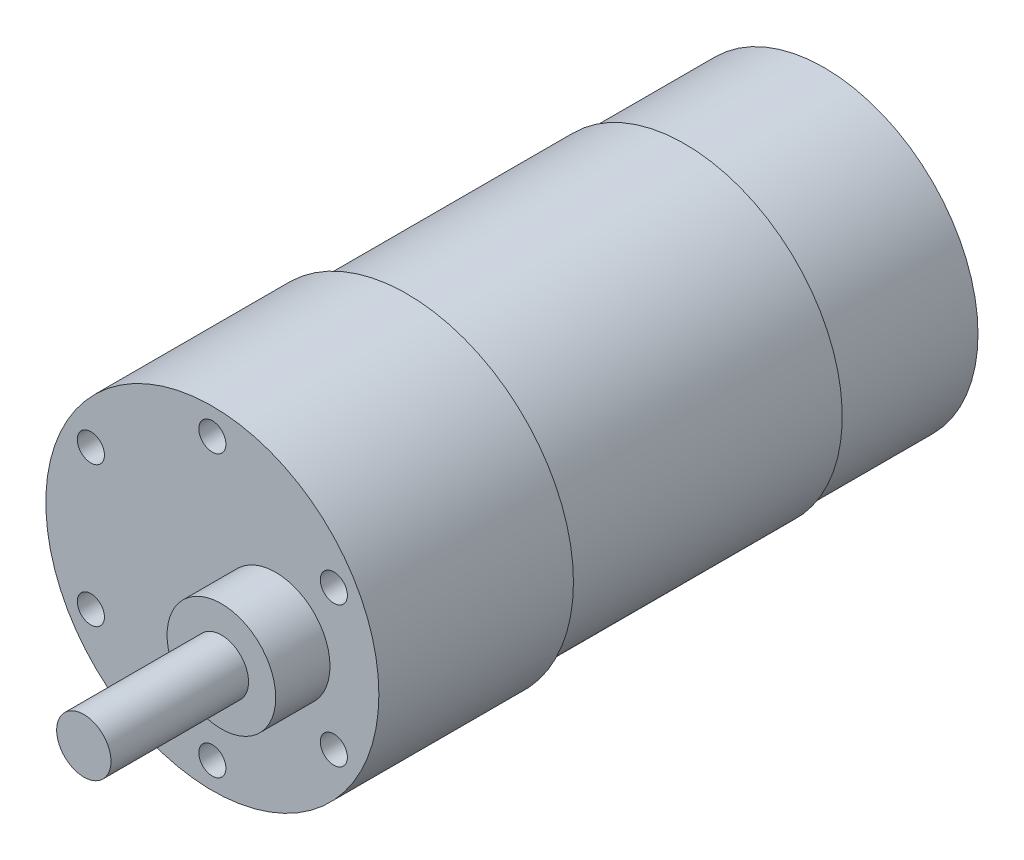
from build123d import *

# Parameters (mm, degrees)
SKETCH_1_R          = 18.4
EXTRUDE_1_DEPTH     = 21.5
SKETCH_1_3_R        = 6
EXTRUDE_2_DEPTH     = 6
SKETCH_1_4_R        = 3
EXTRUDE_3_DEPTH     = 21.2
SKETCH_2_R          = 17.4
EXTRUDE_4_DEPTH     = 30.7
EXTRUDE_START       = 30.7
SKETCH_2_3_R        = 17
EXTRUDE_5_DEPTH     = 15.4
SKETCH_1_5_R        = 1.5
CUT_EXTRUDE_1_DEPTH = 5


with BuildPart() as part:
    # 스케치1 → 보스-돌출1 (new body)
    with BuildSketch(Plane.XY):
        Circle(SKETCH_1_R)
    extrude(amount=-EXTRUDE_1_DEPTH)

    # 스케치1<3> → 보스-돌출2 (add)
    with BuildSketch(Plane.XY):
        with Locations((7, 0)):
            Circle(SKETCH_1_3_R)
    extrude(amount=EXTRUDE_2_DEPTH)

    # 스케치1<4> → 보스-돌출3 (add)
    with BuildSketch(Plane.XY):
        with Locations((7, 0)):
            Circle(SKETCH_1_4_R)
    extrude(amount=EXTRUDE_3_DEPTH)

    # 스케치2 → 보스-돌출4 (add)
    with BuildSketch(Plane(origin=(0, 0, -21.5), x_dir=(-1, 0, 0), z_dir=(0, 0, -1))):
        Circle(SKETCH_2_R)
    extrude(amount=EXTRUDE_4_DEPTH)

    # 스케치2<3> → 보스-돌출5 (add)
    with BuildSketch(Plane(origin=(0, 0, -21.5), x_dir=(-1, 0, 0), z_dir=(0, 0, -1)).offset(EXTRUDE_START)):
        with Locations(Location((0, 0, 0), (0, 0, 180))):
            Circle(SKETCH_2_3_R)
    extrude(amount=EXTRUDE_5_DEPTH)

    # 스케치1<5> → 컷-돌출1 (cut)
    with BuildSketch(Plane.XY):
        with Locations((-13.423393759, -7.75)):
            Circle(SKETCH_1_5_R)
        with Locations((-13.423393759, 7.75)):
            Circle(SKETCH_1_5_R)
        with Locations((0, 15.5)):
            Circle(SKETCH_1_5_R)
        with Locations((13.423393759, 7.75)):
            Circle(SKETCH_1_5_R)
        with Locations((13.423393759, -7.75)):
            Circle(SKETCH_1_5_R)
        with Locations((0, -15.5)):
            Circle(SKETCH_1_5_R)
    extrude(amount=-CUT_EXTRUDE_1_DEPTH, mode=Mode.SUBTRACT)


solid = part.part
